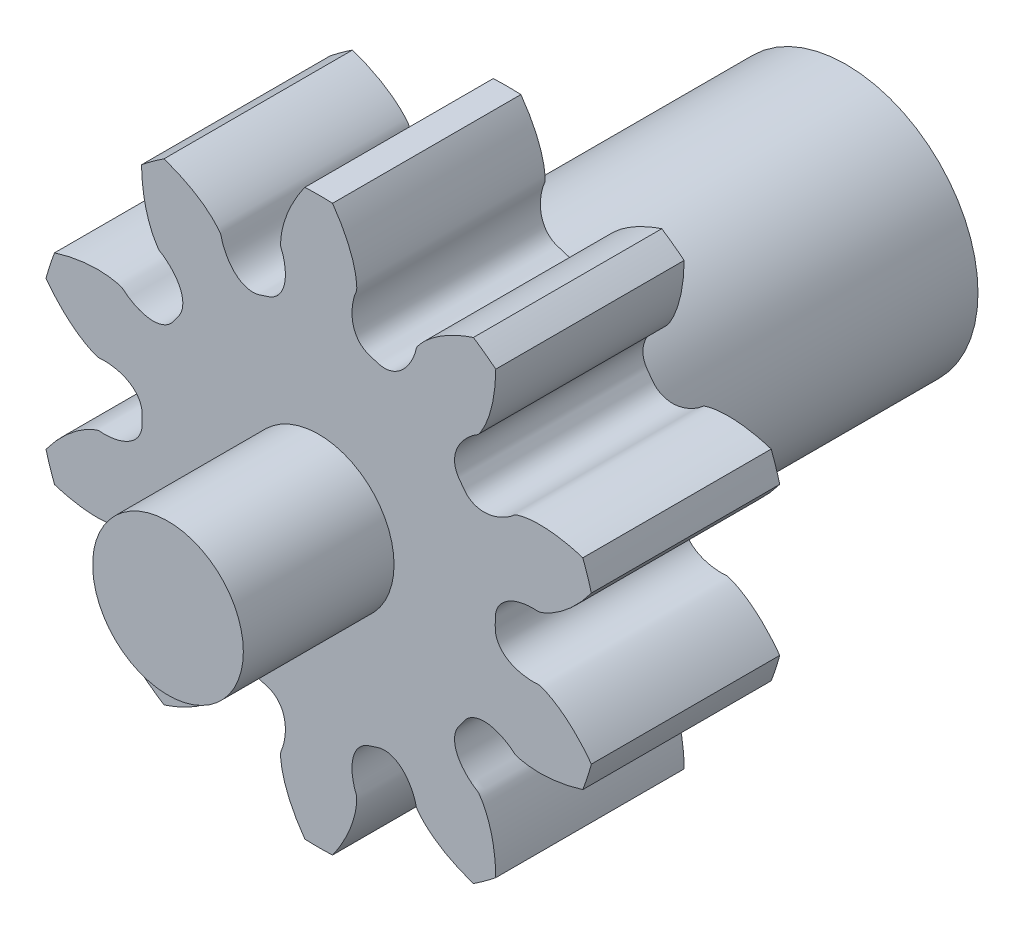
from build123d import *

# Parameters (mm, degrees)
SKETCHREVOLVESPURPINION_W       = 10
SKETCHREVOLVESPURPINION_H       = 15
TOOTHEXTRUDECUTSPURPINION_DEPTH = 5
PATTERNSPURPINION_COUNT         = 10
SKETCH3_R                       = 4
BOSS_EXTRUDE1_DEPTH             = 8
SKETCH4_R                       = 7
BOSS_EXTRUDE2_DEPTH             = 18
CUT_EXTRUDE1_DEPTH              = 15


with BuildPart() as part:
    # SketchRevolveSpurPinion → SpurPinion (revolve)
    with BuildSketch(Plane(origin=(0, 0, 0), x_dir=(0, 0, -1), z_dir=(1, 0, 0))):
        with Locations((0, 7.5)):
            Rectangle(SKETCHREVOLVESPURPINION_W, SKETCHREVOLVESPURPINION_H)
    revolve(axis=Axis((0, 0, 0), (0, 0, -1)))

    # SketchToothSpurPinion → ToothExtrudeCutSpurPinion (cut, symmetric)
    with BuildSketch(Plane.XY):
        with BuildLine():
            ThreePointArc((14.569567696, 4.061197133), (15.125, 0), (14.569567696, -4.061197133))
            add(Edge.make_bspline(
                [(14.569567696, -4.061197133), (14.427859874, -3.861632553), (14.209673665, -3.578045748), (13.904418686, -3.22876315), (13.684999286, -2.997332339), (13.470240269, -2.788455698), (13.261586972, -2.601352826), (13.060428263, -2.435163887), (12.868092511, -2.288952382), (12.685843528, -2.161712646), (12.514877767, -2.05236001), (12.356318142, -1.959778869), (12.211219584, -1.882685067), (12.080538286, -1.820076681), (11.965214456, -1.769860456), (11.842832435, -1.724424039), (11.649179793, -1.649342105), (11.434569911, -1.696941934), (11.239080863, -1.683850658), (11.11883073, -1.675708103), (11.001574361, -1.662620506), (10.887187648, -1.645922904), (10.775720498, -1.625282664), (10.667170857, -1.600776991), (10.561545218, -1.572348483), (10.458845742, -1.53994129), (10.359077942, -1.503459489), (10.262255057, -1.462771216), (10.16840608, -1.417700573), (10.077586537, -1.368023104), (9.989893335, -1.3134618), (9.905484435, -1.253686303), (9.824604013, -1.188317439), (9.747613068, -1.116940646), (9.675023698, -1.039132755), (9.607533684, -0.954507059), (9.546050385, -0.862780951), (9.49170341, -0.763865715), (9.445785092, -0.657974866), (9.409779592, -0.545719815), (9.384800939, -0.428213973), (9.374373909, -0.320691454), (9.370444082, -0.177657223), (9.378345923, 0), (9.370444082, 0.177657223), (9.374373909, 0.320691454), (9.384800939, 0.428213973), (9.409779592, 0.545719815), (9.445785092, 0.657974866), (9.49170341, 0.763865715), (9.546050385, 0.862780951), (9.607533684, 0.954507059), (9.675023698, 1.039132755), (9.747613068, 1.116940646), (9.824604013, 1.188317439), (9.905484435, 1.253686303), (9.989893335, 1.3134618), (10.077586537, 1.368023104), (10.16840608, 1.417700573), (10.262255057, 1.462771216), (10.359077942, 1.503459489), (10.458845742, 1.53994129), (10.561545218, 1.572348483), (10.667170857, 1.600776991), (10.775720498, 1.625282664), (10.887187648, 1.645922904), (11.001574361, 1.662620506), (11.11883073, 1.675708103), (11.239080863, 1.683850658), (11.434569911, 1.696941934), (11.649179793, 1.649342105), (11.842832435, 1.724424039), (11.965214456, 1.769860456), (12.080538286, 1.820076681), (12.211219584, 1.882685067), (12.356318142, 1.959778869), (12.514877767, 2.05236001), (12.685843528, 2.161712646), (12.868092511, 2.288952382), (13.060428263, 2.435163887), (13.261586972, 2.601352826), (13.470240269, 2.788455698), (13.684999286, 2.997332339), (13.904418686, 3.22876315), (14.209673665, 3.578045748), (14.427859874, 3.861632553), (14.569567696, 4.061197133)],
                knots=[0, 0, 0, 0, 0.05171016, 0.07552405, 0.097977146, 0.119069449, 0.138800958, 0.157171673, 0.174181594, 0.189830722, 0.204119057, 0.217046597, 0.228613344, 0.238819298, 0.247664458, 0.255148825, 0.266491119, 0.290788773, 0.29945532, 0.307936773, 0.316241042, 0.324377015, 0.332354693, 0.340185343, 0.347881664, 0.355457971, 0.362930389, 0.370317039, 0.377638219, 0.384916533, 0.392176948, 0.399446703, 0.406754997, 0.414132351, 0.421609511, 0.429215785, 0.43697672, 0.444911182, 0.453028093, 0.461323375, 0.469777943, 0.478357658, 0.484105593, 0.5, 0.515894407, 0.521642342, 0.530222057, 0.538676625, 0.546971907, 0.555088818, 0.56302328, 0.570784215, 0.578390489, 0.585867649, 0.593245003, 0.600553297, 0.607823052, 0.615083467, 0.622361781, 0.629682961, 0.637069611, 0.644542029, 0.652118336, 0.659814657, 0.667645307, 0.675622985, 0.683758958, 0.692063227, 0.70054468, 0.709211227, 0.733508881, 0.744851175, 0.752335542, 0.761180702, 0.771386656, 0.782953403, 0.795880943, 0.810169278, 0.825818406, 0.842828327, 0.861199042, 0.880930551, 0.902022854, 0.92447595, 0.94828984, 1, 1, 1, 1], degree=3))
        make_face()
    toothextrudecutspurpinion = extrude(amount=TOOTHEXTRUDECUTSPURPINION_DEPTH, both=True, mode=Mode.SUBTRACT)

    # PatternSpurPinion: ToothExtrudeCutSpurPinion ×10 about axis
    patternspurpinion_axis = Axis((0, 0, 55), (0, 0, -1))
    for i in range(1, PATTERNSPURPINION_COUNT):
        add(toothextrudecutspurpinion.rotate(patternspurpinion_axis, i * 360 / PATTERNSPURPINION_COUNT), mode=Mode.SUBTRACT)

    # Sketch3 → Boss-Extrude1 (add)
    with BuildSketch(Plane.XY.offset(5)):
        Circle(SKETCH3_R)
    extrude(amount=BOSS_EXTRUDE1_DEPTH)

    # Sketch4 → Boss-Extrude2 (add)
    with BuildSketch(Plane(origin=(0, 0, -5), x_dir=(-1, 0, 0), z_dir=(0, 0, -1))):
        Circle(SKETCH4_R)
    extrude(amount=BOSS_EXTRUDE2_DEPTH)

    # Sketch6 → Cut-Extrude1 (cut)
    with BuildSketch(Plane(origin=(0, 0, -23), x_dir=(-1, 0, 0), z_dir=(0, 0, -1))):
        with BuildLine():
            Line((2.75680975, -3.3), (-2.75680975, -3.3))
            ThreePointArc((-2.75680975, -3.3), (0, 4.3), (2.75680975, -3.3))
        make_face()
    extrude(amount=-CUT_EXTRUDE1_DEPTH, mode=Mode.SUBTRACT)


solid = part.part
